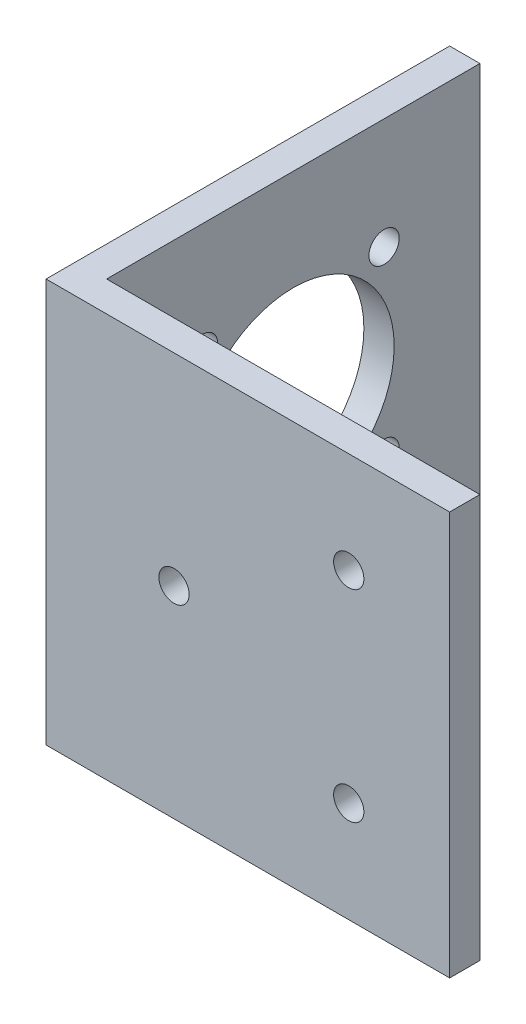
from build123d import *

# Parameters (mm, degrees)
EXTRUDE_1_DEPTH     = 40
SKETCH_2_R          = 10
SKETCH_2_R_2        = 1.5
CUT_EXTRUDE_1_DEPTH = 40
SKETCH_3_R          = 1.5
CUT_EXTRUDE_2_DEPTH = 68.594378464


with BuildPart() as part:
    # Эскиз1 → Бобышка-Вытянуть1 (new body)
    with BuildSketch(Plane(origin=(0, 0, 0), x_dir=(1, 0, 0), z_dir=(0, 1, 0))):
        Polygon((0, 0), (40, 0), (40, 3), (3, 3), (3, 40), (0, 40), align=None)
    extrude(amount=EXTRUDE_1_DEPTH)

    # Эскиз2 → Вырез-Вытянуть1 (cut)
    with BuildSketch(Plane(origin=(3, 0, 0), x_dir=(0, 0, -1), z_dir=(1, 0, 0))):
        with Locations((21.5, 20)):
            Circle(SKETCH_2_R)
        with Locations((30.5, 29)):
            Circle(SKETCH_2_R_2)
        with Locations((30.5, 11)):
            Circle(SKETCH_2_R_2)
        with Locations((12.5, 11)):
            Circle(SKETCH_2_R_2)
        with Locations((12.5, 29)):
            Circle(SKETCH_2_R_2)
    extrude(amount=-CUT_EXTRUDE_1_DEPTH, mode=Mode.SUBTRACT)

    # Эскиз3 → Вырез-Вытянуть2 (cut, through all)
    with BuildSketch(Plane(origin=(0, 0, -3), x_dir=(-1, 0, 0), z_dir=(0, 0, -1))):
        with Locations((-30, 30)):
            Circle(SKETCH_3_R)
        with Locations((-12.679491924, 20)):
            Circle(SKETCH_3_R)
        with Locations((-30, 10)):
            Circle(SKETCH_3_R)
    extrude(amount=-CUT_EXTRUDE_2_DEPTH, mode=Mode.SUBTRACT)


solid = part.part
